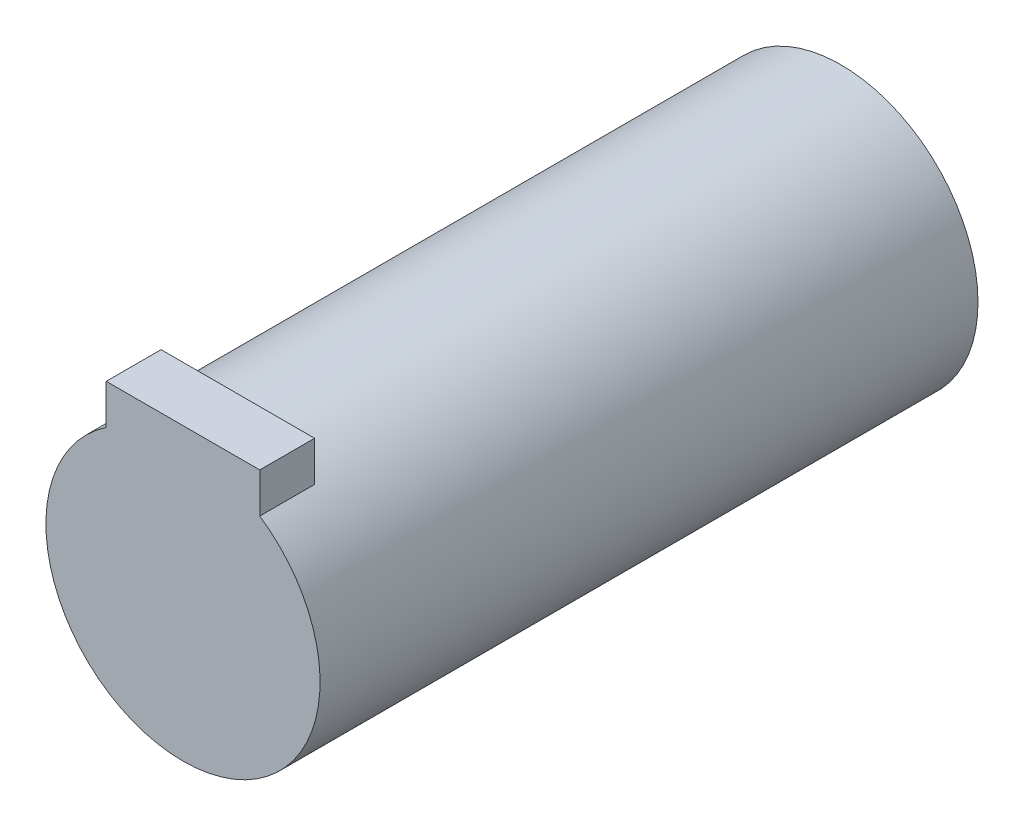
from build123d import *

# Parameters (mm, degrees)
SKETCH1_R           = 12.5
BOSS_EXTRUDE1_DEPTH = 60
SKETCH3_W           = 14
SKETCH3_H           = 5
BOSS_EXTRUDE2_DEPTH = 14


with BuildPart() as part:
    # Sketch1 → Boss-Extrude1 (new body)
    with BuildSketch(Plane.XY):
        Circle(SKETCH1_R)
    extrude(amount=BOSS_EXTRUDE1_DEPTH)

    # Sketch3 → Boss-Extrude2 (add)
    with BuildSketch(Plane(origin=(0, 0, 0), x_dir=(1, 0, 0), z_dir=(0, 1, 0))):
        with Locations((0, -57.5)):
            Rectangle(SKETCH3_W, SKETCH3_H)
    extrude(amount=BOSS_EXTRUDE2_DEPTH)


solid = part.part
